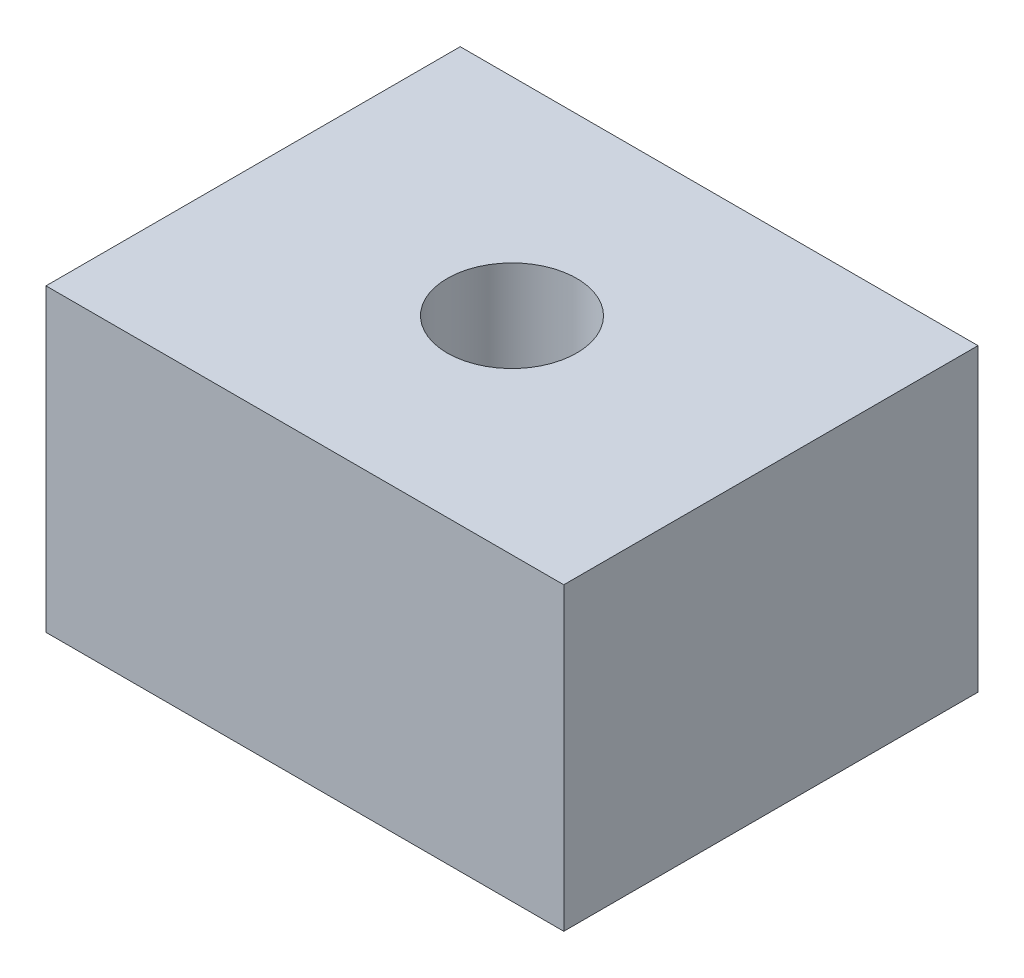
from build123d import *

# Parameters (mm, degrees)
SKETCH1_W           = 25.4
SKETCH1_H           = 20.32
SKETCH1_R           = 3.175
BOSS_EXTRUDE1_DEPTH = 14.722475


with BuildPart() as part:
    # Sketch1 → Boss-Extrude1 (new body)
    with BuildSketch(Plane(origin=(0, 0, 0), x_dir=(1, 0, 0), z_dir=(0, 1, 0))):
        Rectangle(SKETCH1_W, SKETCH1_H)
        with Locations(Location((0, 0, 0), (0, 0, 270))):
            Circle(SKETCH1_R, mode=Mode.SUBTRACT)
    extrude(amount=BOSS_EXTRUDE1_DEPTH)


solid = part.part
